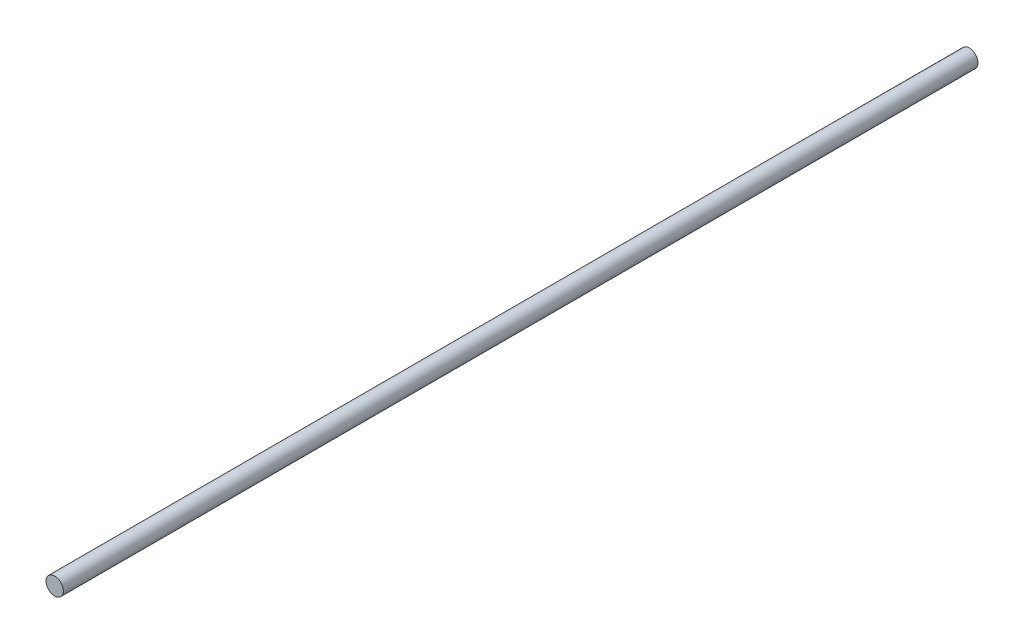
from build123d import *

# Parameters (mm, degrees)
SKETCH2_R           = 4.75
BOSS_EXTRUDE1_DEPTH = 500


with BuildPart() as part:
    # Sketch2 → Boss-Extrude1 (new body)
    with BuildSketch(Plane.XY):
        Circle(SKETCH2_R)
    extrude(amount=BOSS_EXTRUDE1_DEPTH)


solid = part.part
